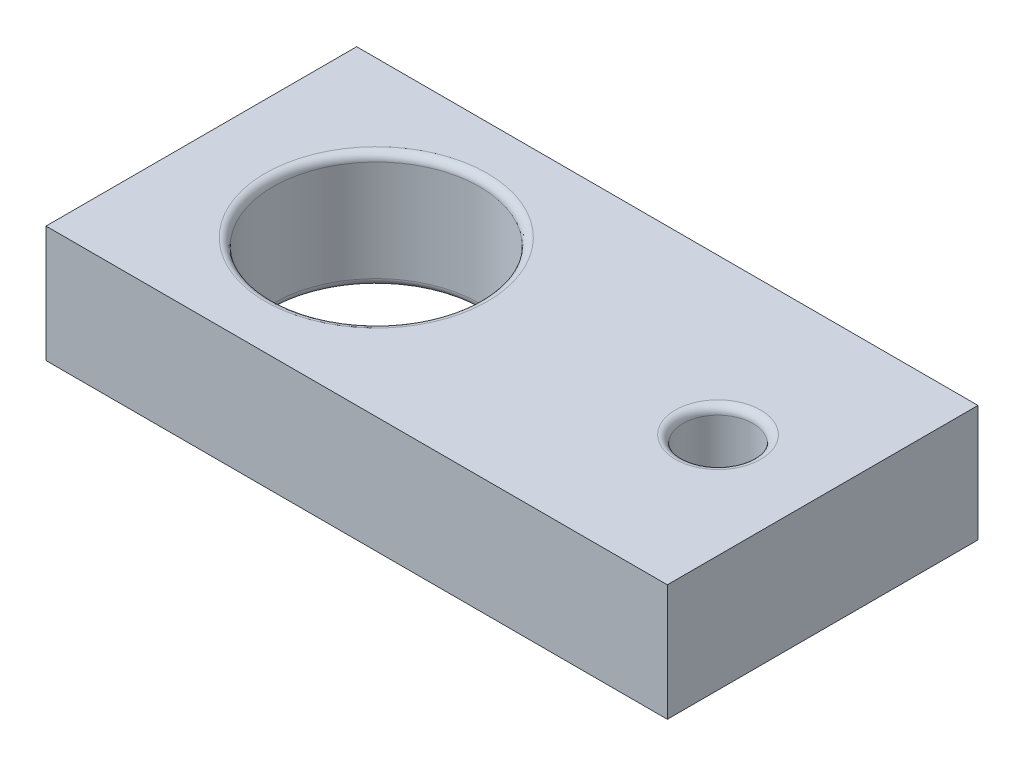
from build123d import *

# Parameters (mm, degrees)
SKETCH_1_W          = 125
SKETCH_1_H          = 40
EXTRUDE_1_DEPTH     = 15
SKETCH_2_R          = 8.9
SKETCH_2_R_2        = 4.5
SKETCH_2_R_3        = 13.3
CUT_EXTRUDE_1_DEPTH = 133.098448136
CHAMFER_1_SIZE      = 1
CHAMFER_2_SIZE      = 1
FILLET_1_R          = 1
SKETCH_3_W          = 40
SKETCH_3_H          = 61.182970239
CUT_EXTRUDE_2_DEPTH = 133.098448148
SKETCH_5_W          = 5
SKETCH_5_H          = 48.384785396
CUT_EXTRUDE_3_DEPTH = 133.098448148


with BuildPart() as part:
    # 草圖1 → 填料-伸長1 (new body)
    with BuildSketch(Plane(origin=(0, 0, 0), x_dir=(1, 0, 0), z_dir=(0, 1, 0))):
        with Locations((62.5, 20)):
            Rectangle(SKETCH_1_W, SKETCH_1_H)
    extrude(amount=EXTRUDE_1_DEPTH)

    # 草圖2 → 除料-伸長1 (cut, through all)
    with BuildSketch(Plane(origin=(0, 15, 0), x_dir=(1, 0, 0), z_dir=(0, 1, 0))):
        with Locations(Location((18.526668527, 20, 0), (0, 0, 270))):
            Circle(SKETCH_2_R)
        with Locations(Location((106.526668527, 20, 0), (0, 0, 270))):
            Circle(SKETCH_2_R_2)
        with Locations(Location((62.526668527, 20, 0), (0, 0, 270))):
            Circle(SKETCH_2_R_3)
    extrude(amount=-CUT_EXTRUDE_1_DEPTH, mode=Mode.SUBTRACT)

    # 導角1
    chamfer_1_edges = [part.edges().sort_by_distance(p)[0] for p in [
        (18.526668527, 15, -28.9),
    ]]
    chamfer(chamfer_1_edges, length=CHAMFER_1_SIZE)

    # 導角2
    chamfer_2_edges = [part.edges().sort_by_distance(p)[0] for p in [
        (18.526668527, 0, -28.9),
    ]]
    chamfer(chamfer_2_edges, length=CHAMFER_2_SIZE)

    # 圓角1
    fillet_1_edges = [part.edges().sort_by_distance(p)[0] for p in [
        (106.526668527, 0, -24.5),
        (106.526668527, 15, -24.5),
        (62.526668527, 0, -33.3),
        (62.526668527, 15, -33.3),
    ]]
    fillet(fillet_1_edges, radius=FILLET_1_R)

    # 草圖3 → 除料-伸長2 (cut, through all)
    with BuildSketch(Plane(origin=(0, 15, 0), x_dir=(1, 0, 0), z_dir=(0, 1, 0))):
        with Locations((20, 30.59148512)):
            Rectangle(SKETCH_3_W, SKETCH_3_H)
    extrude(amount=-CUT_EXTRUDE_2_DEPTH, mode=Mode.SUBTRACT)

    # 草圖5 → 除料-伸長3 (cut, through all)
    with BuildSketch(Plane(origin=(0, 15, 0), x_dir=(1, 0, 0), z_dir=(0, 1, 0))):
        with Locations((122.5, 24.192392698)):
            Rectangle(SKETCH_5_W, SKETCH_5_H)
    extrude(amount=-CUT_EXTRUDE_3_DEPTH, mode=Mode.SUBTRACT)


solid = part.part
